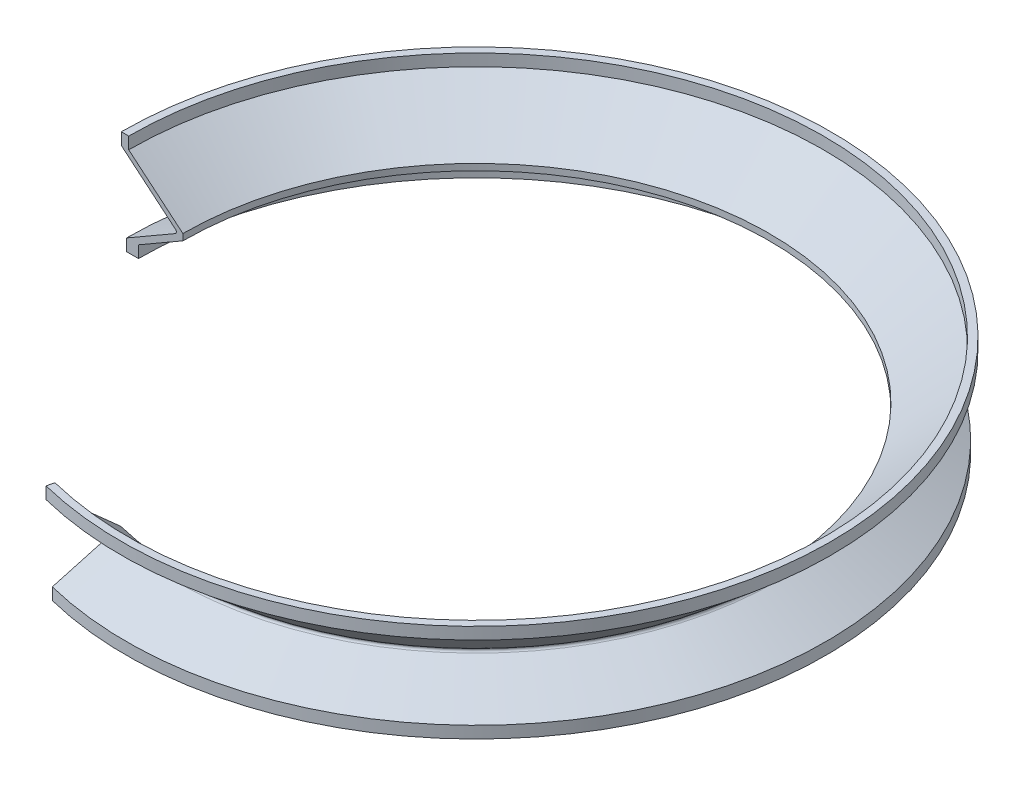
from build123d import *

# Parameters (mm, degrees)
REVOLVE1_ANGLE      = 284
FILLET2_R           = 0.4
BOSS_EXTRUDE1_DEPTH = 2
BOSS_EXTRUDE2_DEPTH = 2


with BuildPart() as part:
    # Sketch1 → Revolve1 (revolve)
    with BuildSketch(Plane.XY):
        Polygon((0.662781953, 0), (-8.871246788, 8), (-7.626667727, 8), (1.462781953, 0.373046127), (1.462781953, -0.692820323), (-5.997472085, -5), (-7.997472085, -5), align=None)
    revolve(axis=Axis((50.698753212, 7.609018033, 0), (0, -1, 0)), revolution_arc=REVOLVE1_ANGLE)

    # Fillet2
    fillet2_edges = [part.edges().sort_by_distance(p)[0] for p in [
        (90.127636631, 0, -30.805219885),
    ]]
    fillet(fillet2_edges, radius=FILLET2_R)

    # Sketch2 → Boss-Extrude1 (add)
    with BuildSketch(Plane(origin=(0, 8, 0), x_dir=(1, 0, 0), z_dir=(0, 1, 0))):
        with BuildLine():
            Line((36.588556817, -56.59290667), (36.287465891, -57.800516414))
            ThreePointArc((36.287465891, -57.800516414), (97.640553804, 36.674954085), (-8.871246788, 0))
            Line((-8.871246788, 0), (-7.626667727, 0))
            ThreePointArc((-7.626667727, 0), (96.65981212, 35.908714704), (36.588556817, -56.59290667))
        make_face()
    extrude(amount=BOSS_EXTRUDE1_DEPTH)

    # Sketch3 → Boss-Extrude2 (add)
    with BuildSketch(Plane.XZ.offset(5)):
        with BuildLine():
            Line((36.498851123, 56.952696554), (36.982694915, 55.012105102))
            ThreePointArc((36.982694915, 55.012105102), (95.375988435, -34.905681712), (-5.997472085, 0))
            Line((-5.997472085, 0), (-7.997472085, 0))
            ThreePointArc((-7.997472085, 0), (96.952009942, -36.137004662), (36.498851123, 56.952696554))
        make_face()
    extrude(amount=BOSS_EXTRUDE2_DEPTH)


solid = part.part
